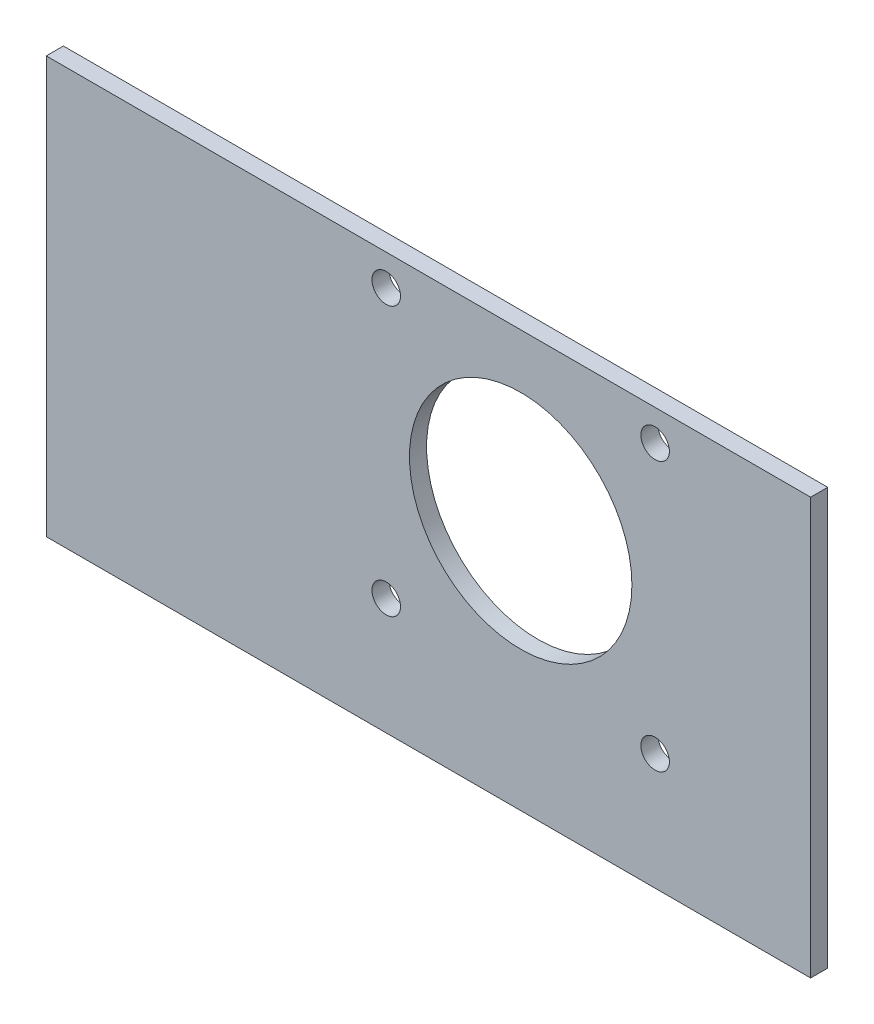
from build123d import *

# Parameters (mm, degrees)
SKETCH1_W           = 134
SKETCH1_H           = 73
SKETCH1_R           = 2.499999994
SKETCH1_R_2         = 19.5
BOSS_EXTRUDE1_DEPTH = 3


with BuildPart() as part:
    # Sketch1 → Boss-Extrude1 (new body)
    with BuildSketch(Plane.XY):
        with Locations((67, 36.5)):
            Rectangle(SKETCH1_W, SKETCH1_H)
        with Locations((59.599751383, 20.430000006)):
            Circle(SKETCH1_R, mode=Mode.SUBTRACT)
        with Locations((106.739751383, 20.430000006)):
            Circle(SKETCH1_R, mode=Mode.SUBTRACT)
        with Locations((59.599751383, 67.570000006)):
            Circle(SKETCH1_R, mode=Mode.SUBTRACT)
        with Locations((106.739751383, 67.570000006)):
            Circle(SKETCH1_R, mode=Mode.SUBTRACT)
        with Locations((83.169751383, 44.000000006)):
            Circle(SKETCH1_R_2, mode=Mode.SUBTRACT)
    extrude(amount=BOSS_EXTRUDE1_DEPTH)


solid = part.part
